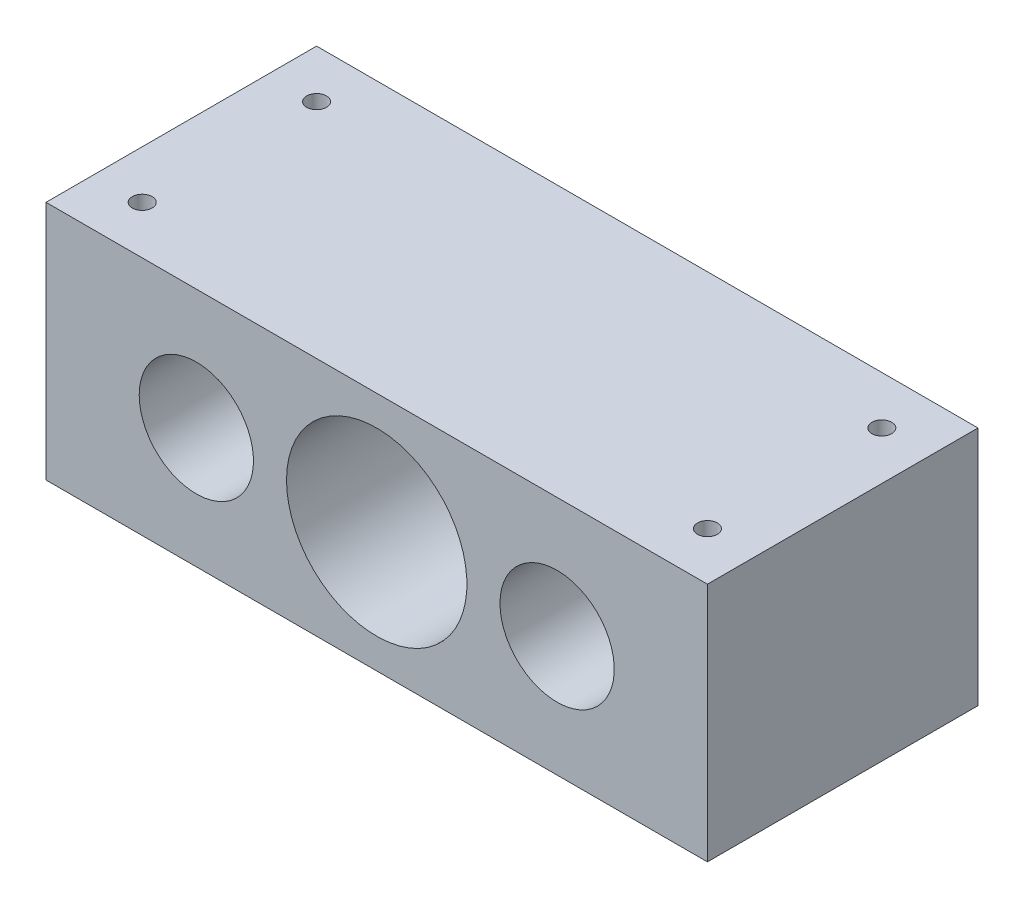
from build123d import *

# Parameters (mm, degrees)
SKETCH1_R             = 9.5
BOSS_EXTRUDE1_DEPTH   = 22.5
M4_TAPPED_HOLE1_D     = 3.3
M4_TAPPED_HOLE1_DEPTH = 10.1
M4_TAPPED_HOLE1_TIP   = 0.991420021
M4_TAPPED_HOLE2_D     = 3.3
M4_TAPPED_HOLE2_DEPTH = 15
M4_TAPPED_HOLE2_TIP   = 0.991420021


with BuildPart() as part:
    # Sketch1 → Boss-Extrude1 (new, symmetric)
    # profile 1 of 2: a face of its own
    with BuildSketch(Plane.XY):
        with BuildLine():
            Line((-55, 0), (0, 0))
            Line((0, 0), (0, 5))
            ThreePointArc((0, 5), (-15, 20), (0, 35))
            Line((0, 35), (0, 40))
            Line((0, 40), (-45, 40))
            Line((-45, 40), (-55, 40))
            Line((-55, 40), (-55, 0))
        make_face()
        with Locations(Location((-30, 20, 0), (0, 0, 180))):
            Circle(SKETCH1_R, mode=Mode.SUBTRACT)
    # profile 2 of 2: a face of its own
    with BuildSketch(Plane.XY):
        with BuildLine():
            Line((0, 5), (0, 0))
            Line((0, 0), (55, 0))
            Line((55, 0), (55, 40))
            Line((55, 40), (45, 40))
            Line((45, 40), (0, 40))
            Line((0, 40), (0, 35))
            ThreePointArc((0, 35), (10.606601718, 30.606601718), (15, 20))
            ThreePointArc((15, 20), (10.606601718, 9.393398282), (0, 5))
        make_face()
        with Locations(Location((30, 20, 0), (0, 0, 180))):
            Circle(SKETCH1_R, mode=Mode.SUBTRACT)
    extrude(amount=BOSS_EXTRUDE1_DEPTH, both=True)

    # M4 Tapped Hole1
    with Locations(Plane(origin=(0, 0, -22.5), x_dir=(-1, 0, 0), z_dir=(0, 0, -1))):
        with Locations((12, 32), (-12, 32), (12, 8), (-12, 8)):
            Hole(M4_TAPPED_HOLE1_D / 2, depth=M4_TAPPED_HOLE1_DEPTH)
            with Locations((0, 0, -(M4_TAPPED_HOLE1_DEPTH + M4_TAPPED_HOLE1_TIP / 2))):  # 118° drill point
                Cone(0, M4_TAPPED_HOLE1_D / 2, M4_TAPPED_HOLE1_TIP, mode=Mode.SUBTRACT)

    # M4 Tapped Hole2
    with Locations(Plane(origin=(0, 40, 0), x_dir=(1, 0, 0), z_dir=(0, 1, 0))):
        with Locations((47, 14.5), (-47, 14.5), (-47, -14.5), (47, -14.5)):
            Hole(M4_TAPPED_HOLE2_D / 2, depth=M4_TAPPED_HOLE2_DEPTH)
            with Locations((0, 0, -(M4_TAPPED_HOLE2_DEPTH + M4_TAPPED_HOLE2_TIP / 2))):  # 118° drill point
                Cone(0, M4_TAPPED_HOLE2_D / 2, M4_TAPPED_HOLE2_TIP, mode=Mode.SUBTRACT)


solid = part.part
